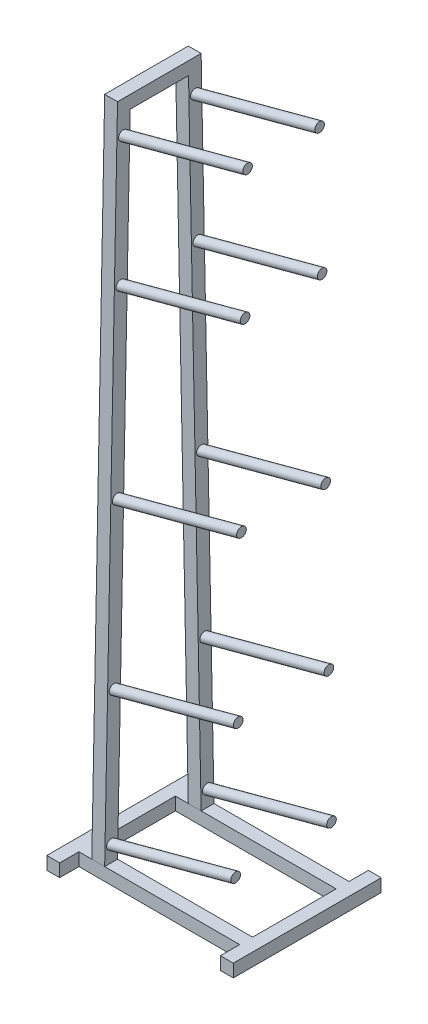
from build123d import *

# Parameters (mm, degrees)
SKETCH1_W           = 25.4
SKETCH1_H           = 25.4
BOSS_EXTRUDE1_DEPTH = 292.1
SKETCH2_W           = 25.4
SKETCH2_H           = 25.4
BOSS_EXTRUDE2_DEPTH = 317.5
BOSS_EXTRUDE3_DEPTH = 25.4
SKETCH4_R           = 9.525
BOSS_EXTRUDE5_DEPTH = 254


with BuildPart() as part:
    # Sketch1 → Boss-Extrude1 (new body)
    with BuildSketch(Plane.XY):
        with Locations((12.7, 12.7)):
            Rectangle(SKETCH1_W, SKETCH1_H)
    boss_extrude1 = extrude(amount=BOSS_EXTRUDE1_DEPTH)

    # Sketch2 → Boss-Extrude2 (add)
    with BuildSketch(Plane(origin=(25.4, 0, 0), x_dir=(0, 0, -1), z_dir=(1, 0, 0))):
        with Locations((-241.3, 12.7)):
            Rectangle(SKETCH2_W, SKETCH2_H)
        with Locations((-50.8, 12.7)):
            Rectangle(SKETCH2_W, SKETCH2_H)
    extrude(amount=BOSS_EXTRUDE2_DEPTH)

    # Mirror1: Boss-Extrude1 across plane
    add(boss_extrude1.mirror(Plane(origin=(184.15, 0, 0), x_dir=(0, 0, 1), z_dir=(1, 0, 0))))

    # Sketch3 → Boss-Extrude3 (add)
    with BuildSketch(Plane.ZY.offset(-50.8)):
        Polygon((38.1, 25.4), (63.5, 1320.8), (88.904882268, 1320.8), (203.195117732, 1320.8), (228.6, 1320.8), (254, 25.4), (228.595117732, 25.4), (203.693156948, 1295.4), (88.406843052, 1295.4), (63.504882268, 25.4), align=None)
    extrude(amount=-BOSS_EXTRUDE3_DEPTH)

    # Sketch4 → Boss-Extrude5 (add, along a direction that is not the sketch's normal)
    with BuildSketch(Plane(origin=(76.2, 0, 0), x_dir=(0, 0, -1), z_dir=(1, 0, 0))):
        with Locations((-240.674544157, 57.298247998)):
            Circle(SKETCH4_R)
        with Locations((-235.530825048, 319.62792253)):
            Circle(SKETCH4_R)
        with Locations((-229.210655655, 641.956561596)):
            Circle(SKETCH4_R)
        with Locations((-217.142014813, 1257.457244551)):
            Circle(SKETCH4_R)
        with Locations((-222.108994477, 1004.141281654)):
            Circle(SKETCH4_R)
    boss_extrude5 = extrude(amount=BOSS_EXTRUDE5_DEPTH, dir=(0.9659258262890673, 0.2588190451025247, -2.638762530576281e-15))

    # Mirror2: Boss-Extrude5 across plane
    add(boss_extrude5.mirror(Plane.XY.offset(146.05)))


solid = part.part
